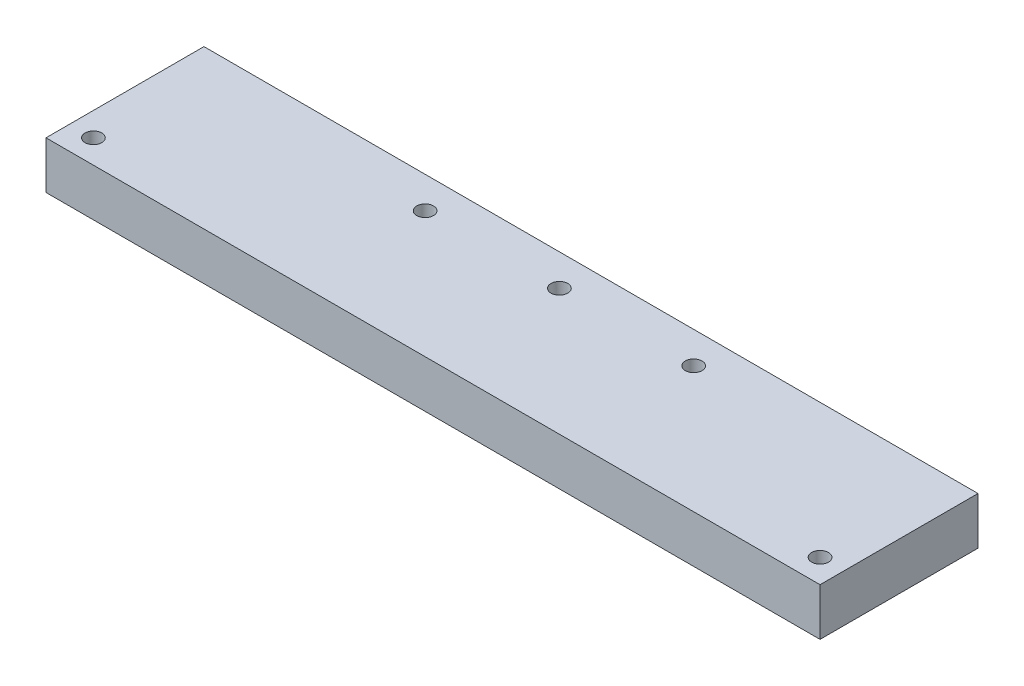
from build123d import *

# Parameters (mm, degrees)
SKETCH1_W                   = 311.15
SKETCH1_H                   = 63.5
BOSS_EXTRUDE1_DEPTH         = 9.525
F_1_4_CLEARANCE_HOLE1_D     = 6.7564
F_1_4_CLEARANCE_HOLE1_DEPTH = 16.51
F_1_4_CLEARANCE_HOLE1_TIP   = 2.029827343


with BuildPart() as part:
    # Sketch1 → Boss-Extrude1 (new, symmetric)
    with BuildSketch(Plane(origin=(0, 0, 0), x_dir=(1, 0, 0), z_dir=(0, 1, 0))):
        Rectangle(SKETCH1_W, SKETCH1_H)
    extrude(amount=BOSS_EXTRUDE1_DEPTH, both=True)

    # 1/4 Clearance Hole1
    with Locations(Plane(origin=(0, 9.525, 0), x_dir=(1, 0, 0), z_dir=(0, 1, 0))):
        with Locations((-53.975, 19.05), (0, 19.05), (53.975, 19.05), (146.05, -22.225), (-146.05, -22.225)):
            Hole(F_1_4_CLEARANCE_HOLE1_D / 2, depth=F_1_4_CLEARANCE_HOLE1_DEPTH)
            with Locations((0, 0, -(F_1_4_CLEARANCE_HOLE1_DEPTH + F_1_4_CLEARANCE_HOLE1_TIP / 2))):  # 118° drill point
                Cone(0, F_1_4_CLEARANCE_HOLE1_D / 2, F_1_4_CLEARANCE_HOLE1_TIP, mode=Mode.SUBTRACT)


solid = part.part
